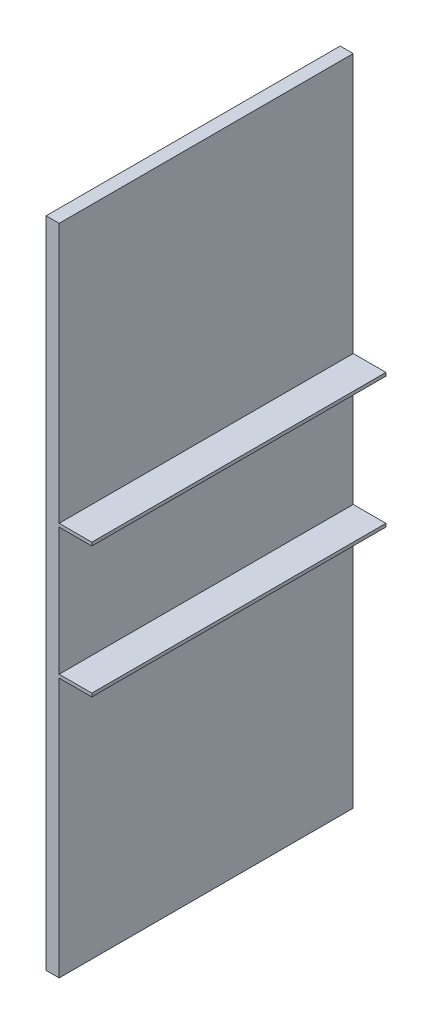
from build123d import *

# Parameters (mm, degrees)
SKETCH1_W           = 14
SKETCH1_H           = 90
BOSS_EXTRUDE1_DEPTH = 200
SKETCH2_W           = 10
SKETCH2_H           = 90
CUT_EXTRUDE1_DEPTH  = 206.119477378
SKETCH3_W           = 90
SKETCH3_H           = 1
BOSS_EXTRUDE2_DEPTH = 10


with BuildPart() as part:
    # Sketch1 → Boss-Extrude1 (new body)
    with BuildSketch(Plane(origin=(0, 0, 0), x_dir=(1, 0, 0), z_dir=(0, 1, 0))):
        Rectangle(SKETCH1_W, SKETCH1_H)
    extrude(amount=BOSS_EXTRUDE1_DEPTH)

    # Sketch2 → Cut-Extrude1 (cut, through all)
    with BuildSketch(Plane(origin=(0, 200, 0), x_dir=(1, 0, 0), z_dir=(0, 1, 0))):
        with Locations((2, 0)):
            Rectangle(SKETCH2_W, SKETCH2_H)
    extrude(amount=-CUT_EXTRUDE1_DEPTH, mode=Mode.SUBTRACT)

    # Sketch3 → Boss-Extrude2 (add)
    with BuildSketch(Plane(origin=(-3, 0, 0), x_dir=(0, 0, -1), z_dir=(1, 0, 0))):
        with Locations((0, 120)):
            Rectangle(SKETCH3_W, SKETCH3_H)
        with Locations((0, 80)):
            Rectangle(SKETCH3_W, SKETCH3_H)
    extrude(amount=BOSS_EXTRUDE2_DEPTH)


solid = part.part
